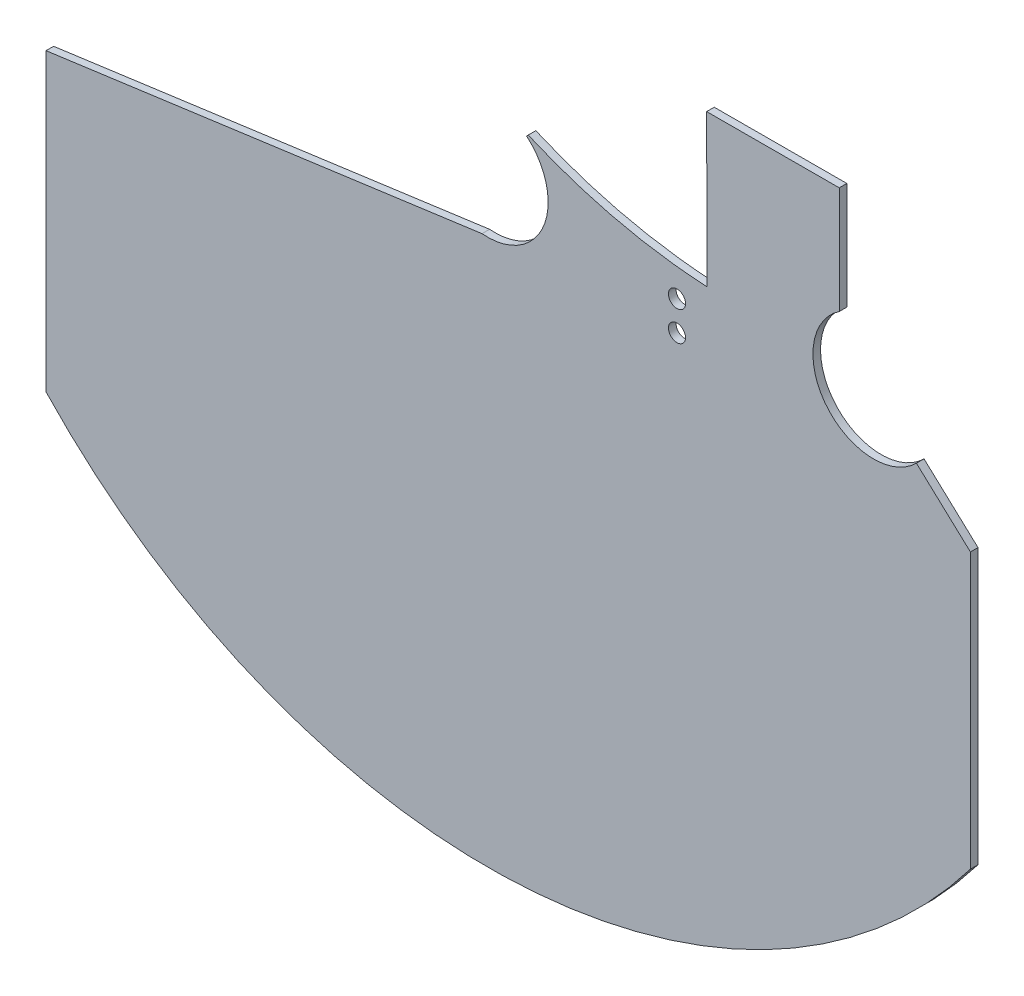
from build123d import *

# Parameters (mm, degrees)
SKETCH1_R           = 2.25
BOSS_EXTRUDE1_DEPTH = 2


with BuildPart() as part:
    # Sketch1 → Boss-Extrude1 (new body)
    with BuildSketch(Plane.XY):
        with BuildLine():
            ThreePointArc((-65.072201119, -14.494287215), (-60.59129068, -32.898192856), (-76.810886122, -42.68118958))
            Line((-76.810886122, -42.68118958), (-191.898124009, -58.394928446))
            Line((-191.898124009, -58.394928446), (-191.898124009, -58.897796779))
            Line((-191.898124009, -58.897796779), (-191.898124009, -136.379261887))
            ThreePointArc((-191.898124009, -136.379261887), (-66.915619532, -186.523885549), (52.083721608, -123.48210166))
            Line((52.083721608, -123.48210166), (52.083721608, -50.984586674))
            Line((52.083721608, -50.984586674), (37.834963232, -37.825461025))
            ThreePointArc((37.834963232, -37.825461025), (14.189227202, -36.712872143), (17.530284751, -13.277940505))
            Line((17.530284751, -13.277940505), (17.466018163, 14.941165213))
            Line((17.466018163, 14.941165213), (-17.533981861, 14.861463987))
            Line((-17.533981861, 14.861463987), (-17.442886515, -25.137999382))
            Line((-17.442886515, -25.137999382), (-17.442885293, -25.138536013))
            add(Edge.make_bspline(
                [(-64.623988745, -14.046074897), (-63.208317509, -14.654705213), (-59.235254763, -16.288548622), (-52.683559955, -18.641296662), (-44.896066709, -20.933273776), (-33.264108999, -23.619131202), (-24.061605806, -24.778728303), (-17.442885293, -25.138536013)],
                knots=[0.054790311, 0.054790311, 0.054790311, 0.054790311, 0.119867337, 0.236316132, 0.352764926, 0.46921372, 0.751953645, 0.751953645, 0.751953645, 0.751953645], degree=3))
            Line((-64.623988745, -14.046074897), (-65.072201119, -14.494287215))
        make_face()
        with Locations((-25.361610976, -39.621277184)):
            Circle(SKETCH1_R, mode=Mode.SUBTRACT)
        with Locations((-25.361610976, -31.831277184)):
            Circle(SKETCH1_R, mode=Mode.SUBTRACT)
    extrude(amount=BOSS_EXTRUDE1_DEPTH)


solid = part.part
